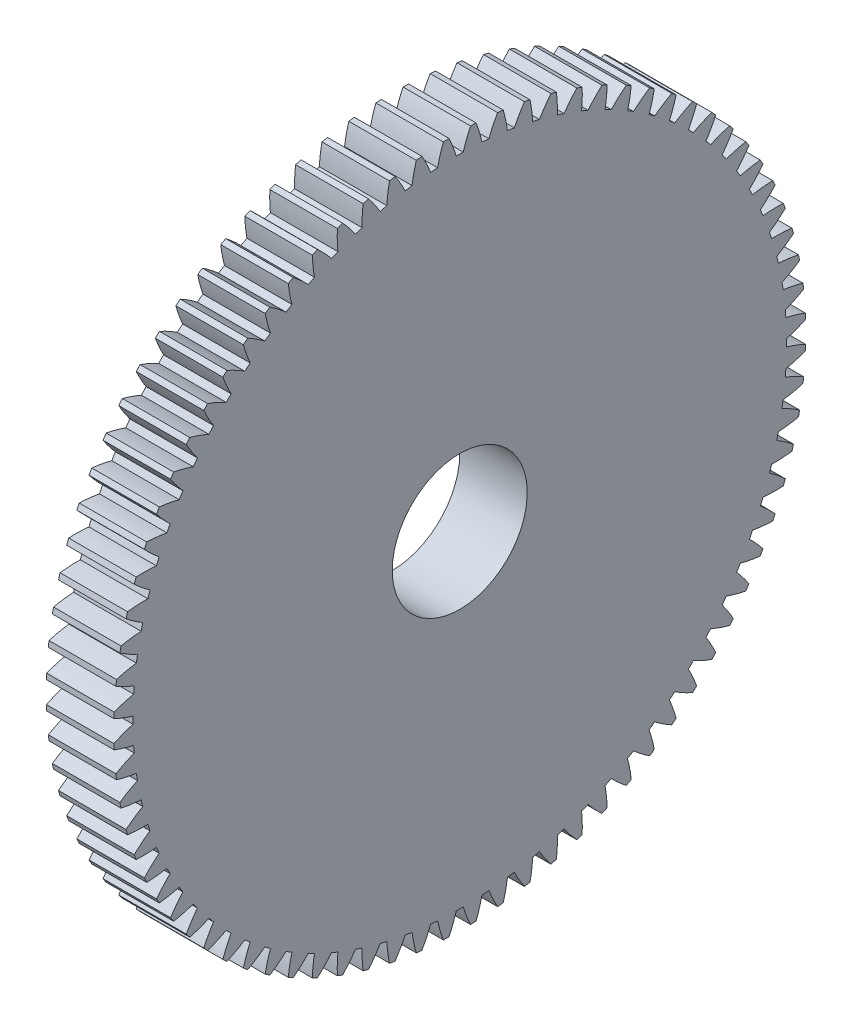
from build123d import *

# Parameters (mm, degrees)
BASPROSKE_W     = 6.35
BASPROSKE_H     = 32.54375
TOOTHCUT_DEPTH  = 47.45980874
TEETHCUTS_COUNT = 80
TEETHCUTS_ANGLE = 355.5
BORSKE_R        = 6.35
BORE_DEPTH      = 50.8000508


with BuildPart() as part:
    # BasProSke → Base-Revolve (revolve)
    with BuildSketch(Plane(origin=(0, 0, 0), x_dir=(1, 0, 0), z_dir=(0, 1, 0)), mode=Mode.PRIVATE) as base_revolve_sk:
        with Locations((3.175, 16.271875)):
            Rectangle(BASPROSKE_W, BASPROSKE_H)
    revolve(base_revolve_sk.sketch.rotate(Axis((-10, 0, 0), (1, 0, 0)), 180), axis=Axis((-10, 0, 0), (1, 0, 0)))

    # TooCutSke → ToothCut (cut, through all)
    with BuildSketch(Plane(origin=(0, 0, 0), x_dir=(0, 0, -1), z_dir=(1, 0, 0))):
        with BuildLine():
            ThreePointArc((0.327817163, 30.744952379), (0, 30.7467), (-0.327817163, 30.744952379))
            ThreePointArc((-0.327817163, 30.744952379), (-0.641780517, 31.66230039), (-1.024813222, 32.553022741))
            ThreePointArc((-1.024813222, 32.553022741), (0, 32.56915), (1.024813222, 32.553022741))
            ThreePointArc((1.024813222, 32.553022741), (0.641780517, 31.66230039), (0.327817163, 30.744952379))
        make_face()
    toothcut = extrude(amount=TOOTHCUT_DEPTH, mode=Mode.SUBTRACT)

    # TeethCuts: ToothCut ×80 about axis
    teethcuts_axis = Axis((-10, 0, 0), (1, 0, 0))
    for i in range(1, TEETHCUTS_COUNT):
        add(toothcut.rotate(teethcuts_axis, i * TEETHCUTS_ANGLE / (TEETHCUTS_COUNT - 1)), mode=Mode.SUBTRACT)

    # BorSke → Bore (cut, symmetric)
    with BuildSketch(Plane(origin=(0, 0, 0), x_dir=(0, 0, -1), z_dir=(1, 0, 0))):
        with Locations(Location((0, 0, 0), (0, 0, 180))):
            Circle(BORSKE_R)
    extrude(amount=BORE_DEPTH, both=True, mode=Mode.SUBTRACT)


solid = part.part
